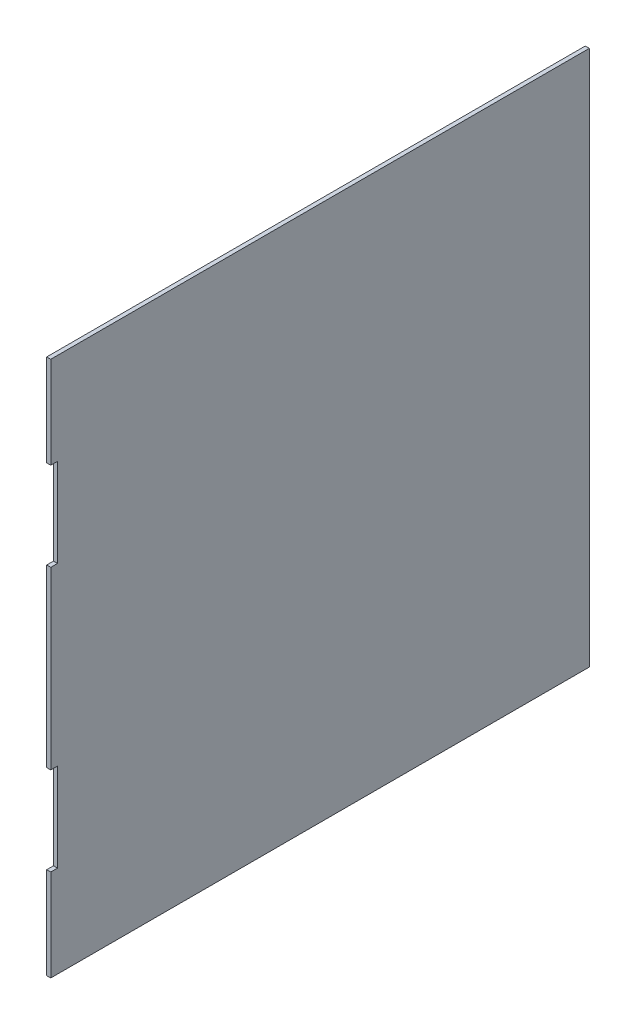
from build123d import *

# Parameters (mm, degrees)
SKETCH_1_W          = 399
SKETCH_1_H          = 397
EXTRUDE_1_DEPTH     = 3
SKETCH_2_W          = 5
SKETCH_2_H          = 65.5
CUT_EXTRUDE_1_DEPTH = 3


with BuildPart() as part:
    # 草圖1 → 填料-伸長1 (new body)
    with BuildSketch(Plane(origin=(0, 0, 0), x_dir=(0, 0, -1), z_dir=(1, 0, 0))):
        Rectangle(SKETCH_1_W, SKETCH_1_H)
    extrude(amount=EXTRUDE_1_DEPTH)

    # 草圖2 → 除料-伸長1 (cut)
    with BuildSketch(Plane(origin=(3, 0, 0), x_dir=(0, 0, -1), z_dir=(1, 0, 0))):
        with Locations((-197, 97.75)):
            Rectangle(SKETCH_2_W, SKETCH_2_H)
        with Locations((-197, -97.75)):
            Rectangle(SKETCH_2_W, SKETCH_2_H)
    extrude(amount=-CUT_EXTRUDE_1_DEPTH, mode=Mode.SUBTRACT)


solid = part.part
